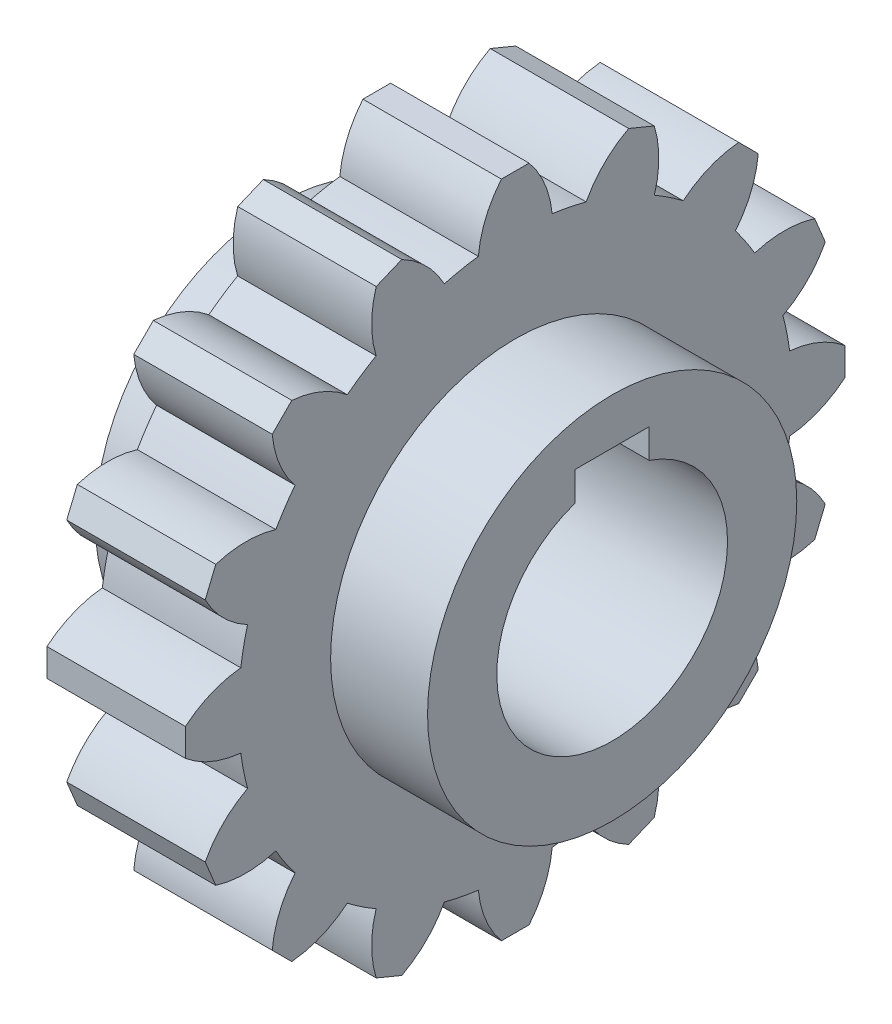
from build123d import *

# Parameters (mm, degrees)
SKETCH1_R           = 30
BOSS_EXTRUDE1_DEPTH = 7.5
BOSS_EXTRUDE2_DEPTH = 15
CIRPATTERN1_COUNT   = 16
SKETCH4_R           = 20
BOSS_EXTRUDE3_DEPTH = 18
CUT_EXTRUDE1_DEPTH  = 63.04491357


with BuildPart() as part:
    # Sketch1 → Boss-Extrude1 (new, symmetric)
    with BuildSketch(Plane(origin=(0, 0, 0), x_dir=(0, 0, -1), z_dir=(1, 0, 0))):
        Circle(SKETCH1_R)
    extrude(amount=BOSS_EXTRUDE1_DEPTH, both=True)

    # Sketch2 → Boss-Extrude2 (add)
    with BuildSketch(Plane(origin=(7.5, 0, 0), x_dir=(0, 0, -1), z_dir=(1, 0, 0))):
        with BuildLine():
            Line((-1.5, 35.732137495), (1.5, 35.732137495))
            ThreePointArc((1.5, 35.732137495), (3.203300204, 32.92101258), (4, 29.732137495))
            ThreePointArc((4, 29.732137495), (0, 30), (-4, 29.732137495))
            ThreePointArc((-4, 29.732137495), (-3.203300204, 32.92101258), (-1.5, 35.732137495))
        make_face()
    boss_extrude2 = extrude(amount=-BOSS_EXTRUDE2_DEPTH)

    # CirPattern1: Boss-Extrude2 ×16 about axis
    cirpattern1_axis = Axis((0, 0, 0), (1, 0, 0))
    for i in range(1, CIRPATTERN1_COUNT):
        add(boss_extrude2.rotate(cirpattern1_axis, i * 360 / CIRPATTERN1_COUNT))

    # Sketch4 → Boss-Extrude3 (add, symmetric)
    with BuildSketch(Plane(origin=(0, 0, 0), x_dir=(0, 0, -1), z_dir=(1, 0, 0))):
        Circle(SKETCH4_R)
    extrude(amount=BOSS_EXTRUDE3_DEPTH, both=True)

    # Sketch5 → Cut-Extrude1 (cut, through all)
    with BuildSketch(Plane(origin=(18, 0, 0), x_dir=(0, 0, -1), z_dir=(1, 0, 0))):
        with BuildLine():
            Line((-4, 15), (4, 15))
            Line((4, 15), (4, 11.842719282))
            ThreePointArc((4, 11.842719282), (0, -12.5), (-4, 11.842719282))
            Line((-4, 11.842719282), (-4, 15))
        make_face()
    extrude(amount=-CUT_EXTRUDE1_DEPTH, mode=Mode.SUBTRACT)


solid = part.part
